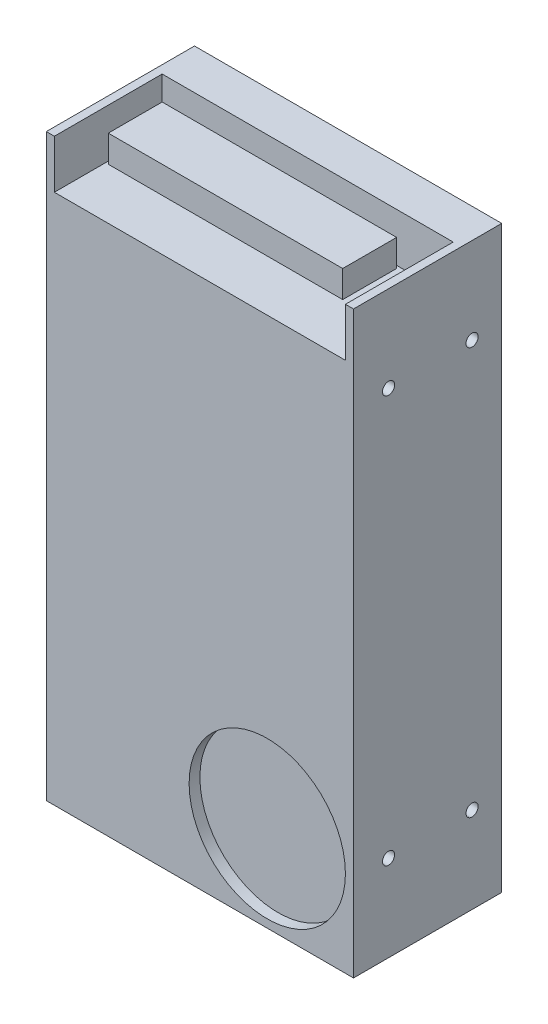
from build123d import *

# Parameters (mm, degrees)
SKETCH1_W           = 114
SKETCH1_H           = 215
BOSS_EXTRUDE1_DEPTH = 55
SKETCH2_W           = 108
SKETCH2_H           = 18
CUT_EXTRUDE1_DEPTH  = 40
SKETCH3_W           = 87
SKETCH3_H           = 20
BOSS_EXTRUDE2_DEPTH = 10
SKETCH4_R           = 29
CUT_EXTRUDE3_DEPTH  = 4
SKETCH5_R           = 2.25
CUT_EXTRUDE4_DEPTH  = 15
SKETCH6_R           = 2.25
CUT_EXTRUDE5_DEPTH  = 167.063993689


with BuildPart() as part:
    # Sketch1 → Boss-Extrude1 (new body)
    with BuildSketch(Plane.XY):
        Rectangle(SKETCH1_W, SKETCH1_H)
    extrude(amount=BOSS_EXTRUDE1_DEPTH)

    # Sketch2 → Cut-Extrude1 (cut)
    with BuildSketch(Plane.XY.offset(55)):
        with Locations((0, 98.5)):
            Rectangle(SKETCH2_W, SKETCH2_H)
    extrude(amount=-CUT_EXTRUDE1_DEPTH, mode=Mode.SUBTRACT)

    # Sketch3 → Boss-Extrude2 (add)
    with BuildSketch(Plane(origin=(0, 89.5, 0), x_dir=(1, 0, 0), z_dir=(0, 1, 0))):
        with Locations((-9.5, -26)):
            Rectangle(SKETCH3_W, SKETCH3_H)
    extrude(amount=BOSS_EXTRUDE2_DEPTH)

    # Sketch4 → Cut-Extrude3 (cut)
    with BuildSketch(Plane.XY.offset(55)):
        with Locations((25, -75.5)):
            Circle(SKETCH4_R)
    extrude(amount=-CUT_EXTRUDE3_DEPTH, mode=Mode.SUBTRACT)

    # Sketch5 → Cut-Extrude4 (cut)
    with BuildSketch(Plane(origin=(0, 0, 0), x_dir=(-1, 0, 0), z_dir=(0, 0, -1))):
        with Locations((-25, 75.5)):
            Circle(SKETCH5_R)
        with Locations((25, 75.5)):
            Circle(SKETCH5_R)
        with Locations((25, -75.5)):
            Circle(SKETCH5_R)
        with Locations((-25, -75.5)):
            Circle(SKETCH5_R)
    extrude(amount=-CUT_EXTRUDE4_DEPTH, mode=Mode.SUBTRACT)

    # Sketch6 → Cut-Extrude5 (cut, through all)
    with BuildSketch(Plane.ZY.offset(57)):
        with Locations(Location((11, 75.5, 0), (0, 0, 270))):
            Circle(SKETCH6_R)
        with Locations(Location((42, 75.5, 0), (0, 0, 270))):
            Circle(SKETCH6_R)
        with Locations(Location((42, -75.5, 0), (0, 0, 270))):
            Circle(SKETCH6_R)
        with Locations(Location((11, -75.5, 0), (0, 0, 270))):
            Circle(SKETCH6_R)
    extrude(amount=-CUT_EXTRUDE5_DEPTH, mode=Mode.SUBTRACT)


solid = part.part
